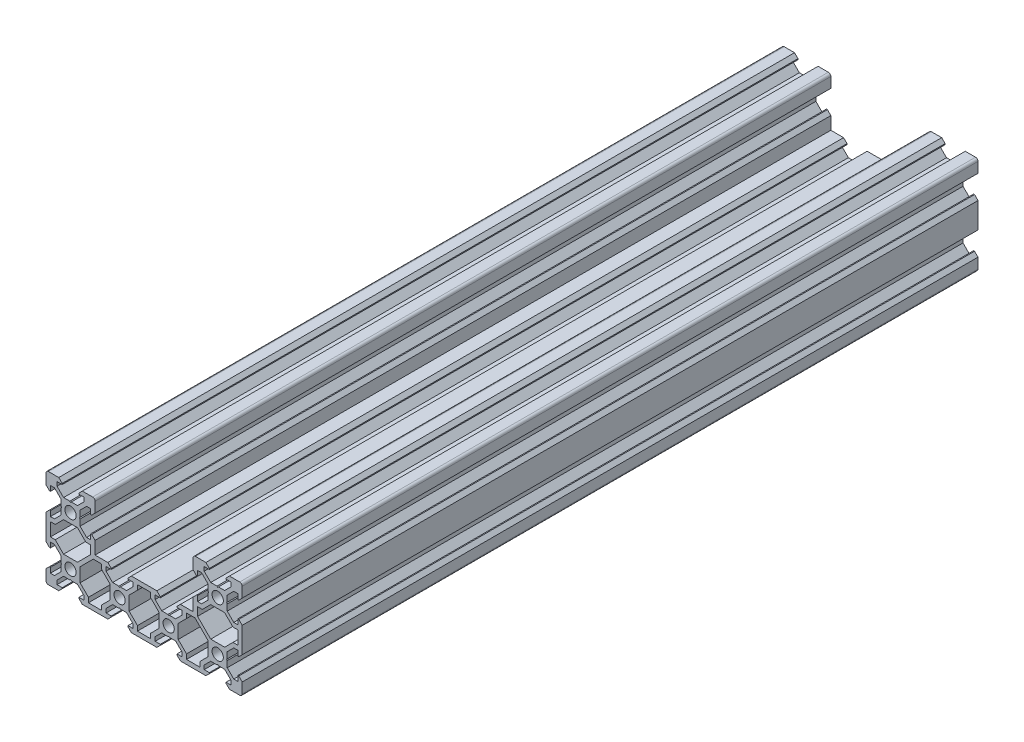
from build123d import *

# Parameters (mm, degrees)
ESBO_O2_R                                 = 2.3
C_BEAM_PF20_15_PERFIL_4080_C_BEAM_1_DEPTH = 300


with BuildPart() as part:
    # Esboço2 → C-beam PF20-15 - PERFIL 4080 C-BEAM(1) (new body)
    with BuildSketch(Plane(origin=(0, 0, 0), x_dir=(0, -1, 0), z_dir=(0, 0, 1))):
        with BuildLine():
            Line((-15.5, 23.439339828), (-12.839339828, 26.1))
            Line((-12.839339828, 26.1), (-10.3, 26.1))
            Line((-10.3, 26.1), (-10, 26.4))
            Line((-10, 26.4), (-9.7, 26.1))
            Line((-9.7, 26.1), (-7.160660172, 26.1))
            Line((-7.160660172, 26.1), (-4.5, 23.439339828))
            Line((-4.5, 23.439339828), (-4.5, 21.8))
            Line((-4.5, 21.8), (-6.6, 21.8))
            Line((-6.6, 21.8), (-6.6, 21.4))
            Line((-6.6, 21.4), (-5.2, 20))
            Line((-5.2, 20), (0, 20))
            Line((0, 20), (0, 14.8))
            Line((0, 14.8), (1.4, 13.4))
            Line((1.4, 13.4), (1.8, 13.4))
            Line((1.8, 13.4), (1.8, 15.5))
            Line((1.8, 15.5), (3.439339828, 15.5))
            Line((3.439339828, 15.5), (6.1, 12.839339828))
            Line((6.1, 12.839339828), (6.1, 10.3))
            Line((6.1, 10.3), (6.4, 10))
            Line((6.4, 10), (6.1, 9.7))
            Line((6.1, 9.7), (6.1, 7.160660172))
            Line((6.1, 7.160660172), (3.439339828, 4.5))
            Line((3.439339828, 4.5), (1.8, 4.5))
            Line((1.8, 4.5), (1.8, 6.6))
            Line((1.8, 6.6), (1.4, 6.6))
            Line((1.4, 6.6), (0, 5.2))
            Line((0, 5.2), (0, -5.2))
            Line((0, -5.2), (1.4, -6.6))
            Line((1.4, -6.6), (1.8, -6.6))
            Line((1.8, -6.6), (1.8, -4.5))
            Line((1.8, -4.5), (3.439339828, -4.5))
            Line((3.439339828, -4.5), (6.1, -7.160660172))
            Line((6.1, -7.160660172), (6.1, -9.7))
            Line((6.1, -9.7), (6.4, -10))
            Line((6.4, -10), (6.1, -10.3))
            Line((6.1, -10.3), (6.1, -12.839339828))
            Line((6.1, -12.839339828), (3.439339828, -15.5))
            Line((3.439339828, -15.5), (1.8, -15.5))
            Line((1.8, -15.5), (1.8, -13.4))
            Line((1.8, -13.4), (1.4, -13.4))
            Line((1.4, -13.4), (0, -14.8))
            Line((0, -14.8), (0, -20))
            Line((0, -20), (-5.2, -20))
            Line((-5.2, -20), (-6.6, -21.4))
            Line((-6.6, -21.4), (-6.6, -21.8))
            Line((-6.6, -21.8), (-4.5, -21.8))
            Line((-4.5, -21.8), (-4.5, -23.439339828))
            Line((-4.5, -23.439339828), (-7.160660172, -26.1))
            Line((-7.160660172, -26.1), (-9.7, -26.1))
            Line((-9.7, -26.1), (-10, -26.4))
            Line((-10, -26.4), (-10.3, -26.1))
            Line((-10.3, -26.1), (-12.839339828, -26.1))
            Line((-12.839339828, -26.1), (-15.5, -23.439339828))
            Line((-15.5, -23.439339828), (-15.5, -21.8))
            Line((-15.5, -21.8), (-13.4, -21.8))
            Line((-13.4, -21.8), (-13.4, -21.4))
            Line((-13.4, -21.4), (-14.8, -20))
            Line((-14.8, -20), (-19, -20))
            ThreePointArc((-19, -20), (-19.707106781, -20.292893219), (-20, -21))
            Line((-20, -21), (-20, -25.2))
            Line((-20, -25.2), (-18.6, -26.6))
            Line((-18.6, -26.6), (-18.2, -26.6))
            Line((-18.2, -26.6), (-18.2, -24.5))
            Line((-18.2, -24.5), (-16.560660172, -24.5))
            Line((-16.560660172, -24.5), (-13.9, -27.160660172))
            Line((-13.9, -27.160660172), (-13.9, -29.7))
            Line((-13.9, -29.7), (-13.6, -30))
            Line((-13.6, -30), (-13.9, -30.3))
            Line((-13.9, -30.3), (-13.9, -32.839339828))
            Line((-13.9, -32.839339828), (-16.560660172, -35.5))
            Line((-16.560660172, -35.5), (-18.2, -35.5))
            Line((-18.2, -35.5), (-18.2, -33.4))
            Line((-18.2, -33.4), (-18.6, -33.4))
            Line((-18.6, -33.4), (-20, -34.8))
            Line((-20, -34.8), (-20, -39))
            ThreePointArc((-20, -39), (-19.707106781, -39.707106781), (-19, -40))
            Line((-19, -40), (-14.8, -40))
            Line((-14.8, -40), (-13.4, -38.6))
            Line((-13.4, -38.6), (-13.4, -38.2))
            Line((-13.4, -38.2), (-15.5, -38.2))
            Line((-15.5, -38.2), (-15.5, -36.560660172))
            Line((-15.5, -36.560660172), (-12.839339828, -33.9))
            Line((-12.839339828, -33.9), (-10.3, -33.9))
            Line((-10.3, -33.9), (-10, -33.6))
            Line((-10, -33.6), (-9.7, -33.9))
            Line((-9.7, -33.9), (-7.160660172, -33.9))
            Line((-7.160660172, -33.9), (-4.5, -36.560660172))
            Line((-4.5, -36.560660172), (-4.5, -38.2))
            Line((-4.5, -38.2), (-6.6, -38.2))
            Line((-6.6, -38.2), (-6.6, -38.6))
            Line((-6.6, -38.6), (-5.2, -40))
            Line((-5.2, -40), (5.2, -40))
            Line((5.2, -40), (6.6, -38.6))
            Line((6.6, -38.6), (6.6, -38.2))
            Line((6.6, -38.2), (4.5, -38.2))
            Line((4.5, -38.2), (4.5, -36.560660172))
            Line((4.5, -36.560660172), (7.160660172, -33.9))
            Line((7.160660172, -33.9), (9.7, -33.9))
            Line((9.7, -33.9), (10, -33.6))
            Line((10, -33.6), (10.3, -33.9))
            Line((10.3, -33.9), (12.839339828, -33.9))
            Line((12.839339828, -33.9), (15.5, -36.560660172))
            Line((15.5, -36.560660172), (15.5, -38.2))
            Line((15.5, -38.2), (13.4, -38.2))
            Line((13.4, -38.2), (13.4, -38.6))
            Line((13.4, -38.6), (14.8, -40))
            Line((14.8, -40), (19, -40))
            ThreePointArc((19, -40), (19.707106781, -39.707106781), (20, -39))
            Line((20, -39), (20, -34.8))
            Line((20, -34.8), (18.6, -33.4))
            Line((18.6, -33.4), (18.2, -33.4))
            Line((18.2, -33.4), (18.2, -35.5))
            Line((18.2, -35.5), (16.560660172, -35.5))
            Line((16.560660172, -35.5), (13.9, -32.839339828))
            Line((13.9, -32.839339828), (13.9, -30.3))
            Line((13.9, -30.3), (13.6, -30))
            Line((13.6, -30), (13.9, -29.7))
            Line((13.9, -29.7), (13.9, -27.160660172))
            Line((13.9, -27.160660172), (16.560660172, -24.5))
            Line((16.560660172, -24.5), (18.2, -24.5))
            Line((18.2, -24.5), (18.2, -26.6))
            Line((18.2, -26.6), (18.6, -26.6))
            Line((18.6, -26.6), (20, -25.2))
            Line((20, -25.2), (20, -14.8))
            Line((20, -14.8), (18.6, -13.4))
            Line((18.6, -13.4), (18.2, -13.4))
            Line((18.2, -13.4), (18.2, -15.5))
            Line((18.2, -15.5), (16.560660172, -15.5))
            Line((16.560660172, -15.5), (13.9, -12.839339828))
            Line((13.9, -12.839339828), (13.9, -10.3))
            Line((13.9, -10.3), (13.6, -10))
            Line((13.6, -10), (13.9, -9.7))
            Line((13.9, -9.7), (13.9, -7.160660172))
            Line((13.9, -7.160660172), (16.560660172, -4.5))
            Line((16.560660172, -4.5), (18.2, -4.5))
            Line((18.2, -4.5), (18.2, -6.6))
            Line((18.2, -6.6), (18.6, -6.6))
            Line((18.6, -6.6), (20, -5.2))
            Line((20, -5.2), (20, 5.2))
            Line((20, 5.2), (18.6, 6.6))
            Line((18.6, 6.6), (18.2, 6.6))
            Line((18.2, 6.6), (18.2, 4.5))
            Line((18.2, 4.5), (16.560660172, 4.5))
            Line((16.560660172, 4.5), (13.9, 7.160660172))
            Line((13.9, 7.160660172), (13.9, 9.7))
            Line((13.9, 9.7), (13.6, 10))
            Line((13.6, 10), (13.9, 10.3))
            Line((13.9, 10.3), (13.9, 12.839339828))
            Line((13.9, 12.839339828), (16.560660172, 15.5))
            Line((16.560660172, 15.5), (18.2, 15.5))
            Line((18.2, 15.5), (18.2, 13.4))
            Line((18.2, 13.4), (18.6, 13.4))
            Line((18.6, 13.4), (20, 14.8))
            Line((20, 14.8), (20, 25.2))
            Line((20, 25.2), (18.6, 26.6))
            Line((18.6, 26.6), (18.2, 26.6))
            Line((18.2, 26.6), (18.2, 24.5))
            Line((18.2, 24.5), (16.560660172, 24.5))
            Line((16.560660172, 24.5), (13.9, 27.160660172))
            Line((13.9, 27.160660172), (13.9, 29.7))
            Line((13.9, 29.7), (13.6, 30))
            Line((13.6, 30), (13.9, 30.3))
            Line((13.9, 30.3), (13.9, 32.839339828))
            Line((13.9, 32.839339828), (16.560660172, 35.5))
            Line((16.560660172, 35.5), (18.2, 35.5))
            Line((18.2, 35.5), (18.2, 33.4))
            Line((18.2, 33.4), (18.6, 33.4))
            Line((18.6, 33.4), (20, 34.8))
            Line((20, 34.8), (20, 39))
            ThreePointArc((20, 39), (19.707106781, 39.707106781), (19, 40))
            Line((19, 40), (14.8, 40))
            Line((14.8, 40), (13.4, 38.6))
            Line((13.4, 38.6), (13.4, 38.2))
            Line((13.4, 38.2), (15.5, 38.2))
            Line((15.5, 38.2), (15.5, 36.560660172))
            Line((15.5, 36.560660172), (12.839339828, 33.9))
            Line((12.839339828, 33.9), (10.3, 33.9))
            Line((10.3, 33.9), (10, 33.6))
            Line((10, 33.6), (9.7, 33.9))
            Line((9.7, 33.9), (7.160660172, 33.9))
            Line((7.160660172, 33.9), (4.5, 36.560660172))
            Line((4.5, 36.560660172), (4.5, 38.2))
            Line((4.5, 38.2), (6.6, 38.2))
            Line((6.6, 38.2), (6.6, 38.6))
            Line((6.6, 38.6), (5.2, 40))
            Line((5.2, 40), (-5.2, 40))
            Line((-5.2, 40), (-6.6, 38.6))
            Line((-6.6, 38.6), (-6.6, 38.2))
            Line((-6.6, 38.2), (-4.5, 38.2))
            Line((-4.5, 38.2), (-4.5, 36.560660172))
            Line((-4.5, 36.560660172), (-7.160660172, 33.9))
            Line((-7.160660172, 33.9), (-9.7, 33.9))
            Line((-9.7, 33.9), (-10, 33.6))
            Line((-10, 33.6), (-10.3, 33.9))
            Line((-10.3, 33.9), (-12.839339828, 33.9))
            Line((-12.839339828, 33.9), (-15.5, 36.560660172))
            Line((-15.5, 36.560660172), (-15.5, 38.2))
            Line((-15.5, 38.2), (-13.4, 38.2))
            Line((-13.4, 38.2), (-13.4, 38.6))
            Line((-13.4, 38.6), (-14.8, 40))
            Line((-14.8, 40), (-19, 40))
            ThreePointArc((-19, 40), (-19.707106781, 39.707106781), (-20, 39))
            Line((-20, 39), (-20, 34.8))
            Line((-20, 34.8), (-18.6, 33.4))
            Line((-18.6, 33.4), (-18.2, 33.4))
            Line((-18.2, 33.4), (-18.2, 35.5))
            Line((-18.2, 35.5), (-16.560660172, 35.5))
            Line((-16.560660172, 35.5), (-13.9, 32.839339828))
            Line((-13.9, 32.839339828), (-13.9, 30.3))
            Line((-13.9, 30.3), (-13.6, 30))
            Line((-13.6, 30), (-13.9, 29.7))
            Line((-13.9, 29.7), (-13.9, 27.160660172))
            Line((-13.9, 27.160660172), (-16.560660172, 24.5))
            Line((-16.560660172, 24.5), (-18.2, 24.5))
            Line((-18.2, 24.5), (-18.2, 26.6))
            Line((-18.2, 26.6), (-18.6, 26.6))
            Line((-18.6, 26.6), (-20, 25.2))
            Line((-20, 25.2), (-20, 21))
            ThreePointArc((-20, 21), (-19.707106781, 20.292893219), (-19, 20))
            Line((-19, 20), (-14.8, 20))
            Line((-14.8, 20), (-13.4, 21.4))
            Line((-13.4, 21.4), (-13.4, 21.8))
            Line((-13.4, 21.8), (-15.5, 21.8))
            Line((-15.5, 21.8), (-15.5, 23.439339828))
        make_face()
        with Locations((10, -30)):
            Circle(ESBO_O2_R, mode=Mode.SUBTRACT)
        with Locations((-10, -30)):
            Circle(ESBO_O2_R, mode=Mode.SUBTRACT)
        with Locations((10, -10)):
            Circle(ESBO_O2_R, mode=Mode.SUBTRACT)
        with Locations((10, 10)):
            Circle(ESBO_O2_R, mode=Mode.SUBTRACT)
        with Locations((-10, 30)):
            Circle(ESBO_O2_R, mode=Mode.SUBTRACT)
        with Locations((10, 30)):
            Circle(ESBO_O2_R, mode=Mode.SUBTRACT)
        Polygon((-2.7, -36.239339828), (-2.7, -38.2), (2.7, -38.2), (2.7, -36.239339828), (6.1, -32.839339828), (6.1, -27.160660172), (0.739339828, -21.8), (-2.7, -21.8), (-2.7, -23.760660172), (-6.1, -27.160660172), (-6.1, -32.839339828), align=None, mode=Mode.SUBTRACT)
        Polygon((16.239339828, -22.7), (18.2, -22.7), (18.2, -17.3), (16.239339828, -17.3), (12.839339828, -13.9), (7.160660172, -13.9), (3.760660172, -17.3), (1.8, -17.3), (1.8, -20.739339828), (7.160660172, -26.1), (12.839339828, -26.1), align=None, mode=Mode.SUBTRACT)
        Polygon((16.239339828, -2.7), (18.2, -2.7), (18.2, 2.7), (16.239339828, 2.7), (12.839339828, 6.1), (7.160660172, 6.1), (3.760660172, 2.7), (1.8, 2.7), (1.8, -2.7), (3.760660172, -2.7), (7.160660172, -6.1), (12.839339828, -6.1), align=None, mode=Mode.SUBTRACT)
        Polygon((2.7, 38.2), (-2.7, 38.2), (-2.7, 36.239339828), (-6.1, 32.839339828), (-6.1, 27.160660172), (-2.7, 23.760660172), (-2.7, 21.8), (0.739339828, 21.8), (6.1, 27.160660172), (6.1, 32.839339828), (2.7, 36.239339828), align=None, mode=Mode.SUBTRACT)
        Polygon((18.2, 17.3), (18.2, 22.7), (16.239339828, 22.7), (12.839339828, 26.1), (7.160660172, 26.1), (1.8, 20.739339828), (1.8, 17.3), (3.760660172, 17.3), (7.160660172, 13.9), (12.839339828, 13.9), (16.239339828, 17.3), align=None, mode=Mode.SUBTRACT)
    extrude(amount=C_BEAM_PF20_15_PERFIL_4080_C_BEAM_1_DEPTH)


solid = part.part
